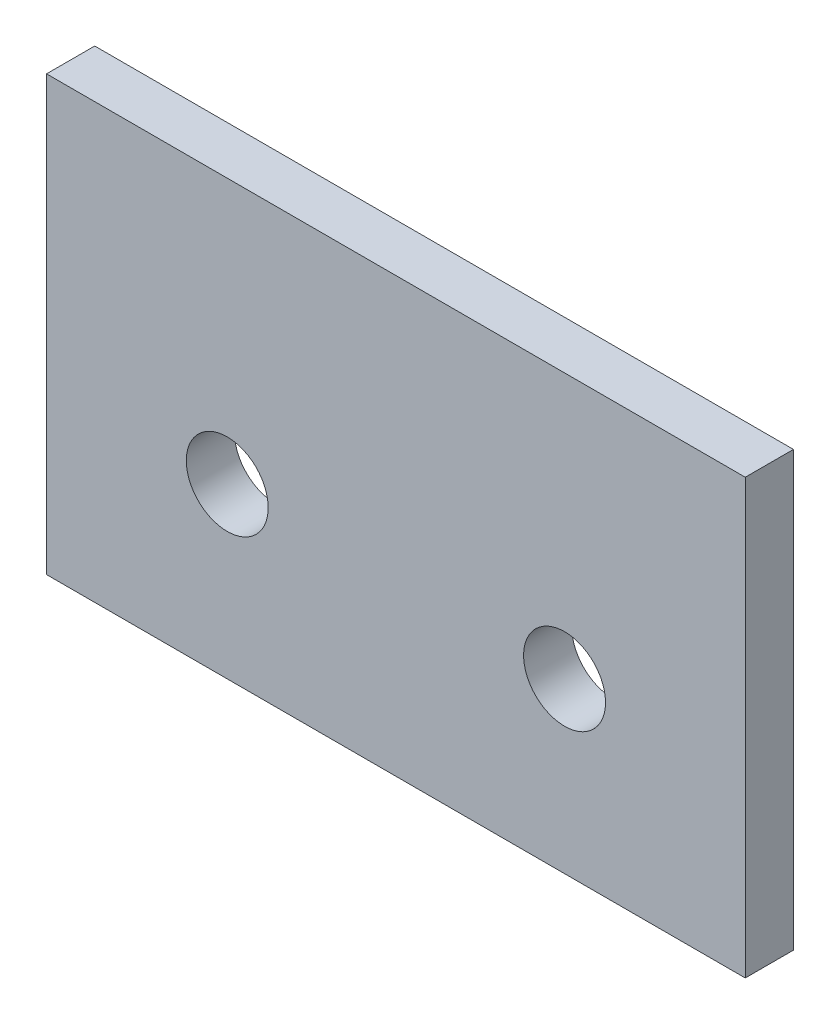
from build123d import *

# Parameters (mm, degrees)
SKETCH_1_W      = 29
SKETCH_1_H      = 18
SKETCH_1_R      = 1.7
EXTRUDE_1_DEPTH = 2


with BuildPart() as part:
    # 草图1 → 凸台-拉伸1 (new body)
    with BuildSketch(Plane.XY):
        with Locations((14.5, 9)):
            Rectangle(SKETCH_1_W, SKETCH_1_H)
        with Locations((21.5, 7)):
            Circle(SKETCH_1_R, mode=Mode.SUBTRACT)
        with Locations(Location((7.5, 7, 0), (0, 0, 180))):
            Circle(SKETCH_1_R, mode=Mode.SUBTRACT)
    extrude(amount=EXTRUDE_1_DEPTH)


solid = part.part
